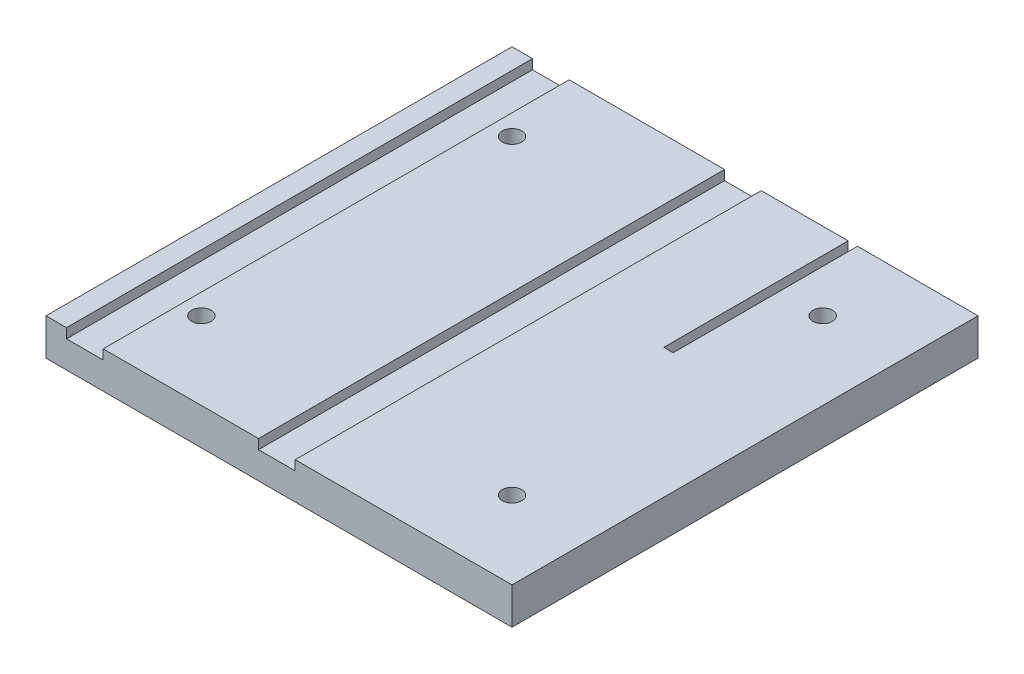
from build123d import *

# Parameters (mm, degrees)
SKETCH1_W           = 152.4
SKETCH1_H           = 152.4
SKETCH1_R           = 3.175
BOSS_EXTRUDE1_DEPTH = 12
SKETCH2_W           = 12.0000014
SKETCH2_H           = 152.4
SKETCH2_W_2         = 3.076317806
SKETCH2_H_2         = 104.082085775
CUT_EXTRUDE1_DEPTH  = 3.175


with BuildPart() as part:
    # Sketch1 → Boss-Extrude1 (new body)
    with BuildSketch(Plane(origin=(0, 0, 0), x_dir=(1, 0, 0), z_dir=(0, 1, 0))):
        Rectangle(SKETCH1_W, SKETCH1_H)
        with Locations(Location((-50.8, 50.8, 0), (0, 0, 270))):
            Circle(SKETCH1_R, mode=Mode.SUBTRACT)
        with Locations(Location((50.8, 50.8, 0), (0, 0, 270))):
            Circle(SKETCH1_R, mode=Mode.SUBTRACT)
        with Locations(Location((-50.8, -50.8, 0), (0, 0, 270))):
            Circle(SKETCH1_R, mode=Mode.SUBTRACT)
        with Locations(Location((50.8, -50.8, 0), (0, 0, 270))):
            Circle(SKETCH1_R, mode=Mode.SUBTRACT)
    extrude(amount=BOSS_EXTRUDE1_DEPTH)

    # Sketch2 → Cut-Extrude1 (cut)
    with BuildSketch(Plane(origin=(0, 12, 0), x_dir=(1, 0, 0), z_dir=(0, 1, 0))):
        with Locations((-63.5, 0)):
            Rectangle(SKETCH2_W, SKETCH2_H)
        with Locations((-0.7000113, 0)):
            Rectangle(SKETCH2_W, SKETCH2_H)
        with Locations((35.270676847, 67.933500252)):
            Rectangle(SKETCH2_W_2, SKETCH2_H_2)
    extrude(amount=-CUT_EXTRUDE1_DEPTH, mode=Mode.SUBTRACT)


solid = part.part
